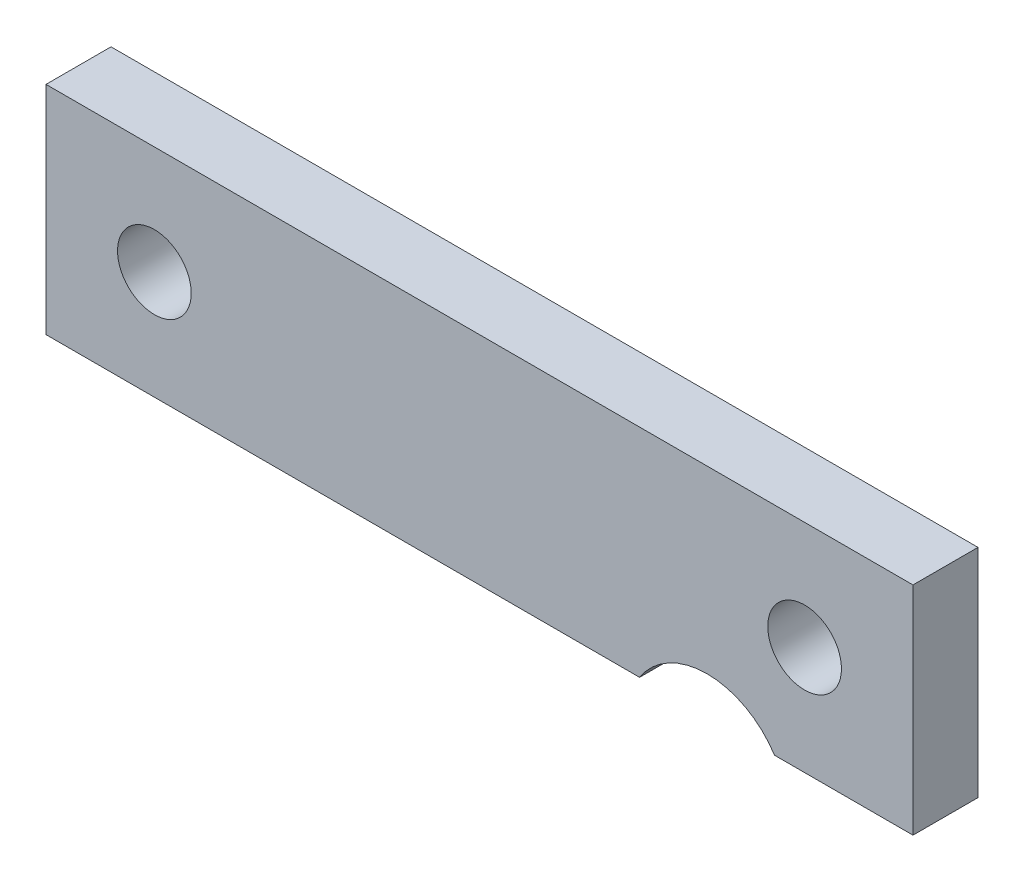
from build123d import *

# Parameters (mm, degrees)
MAIN_PROFILE_SKETCH_R = 1.7
MAIN_EXTRUSION_DEPTH  = 3


with BuildPart() as part:
    # Main Profile Sketch → Main Extrusion (new body)
    with BuildSketch(Plane.XY.offset(44.5)):
        with BuildLine():
            Line((35, -31.5), (75, -31.5))
            Line((75, -31.5), (75, -41.5))
            Line((75, -41.5), (68.612876483, -41.5))
            ThreePointArc((68.612876483, -41.5), (65.5, -39.8), (62.387123517, -41.5))
            Line((62.387123517, -41.5), (35, -41.5))
            Line((35, -41.5), (35, -31.5))
        make_face()
        with Locations((40, -36.5)):
            Circle(MAIN_PROFILE_SKETCH_R, mode=Mode.SUBTRACT)
        with Locations((70, -36.5)):
            Circle(MAIN_PROFILE_SKETCH_R, mode=Mode.SUBTRACT)
    extrude(amount=-MAIN_EXTRUSION_DEPTH)


solid = part.part
